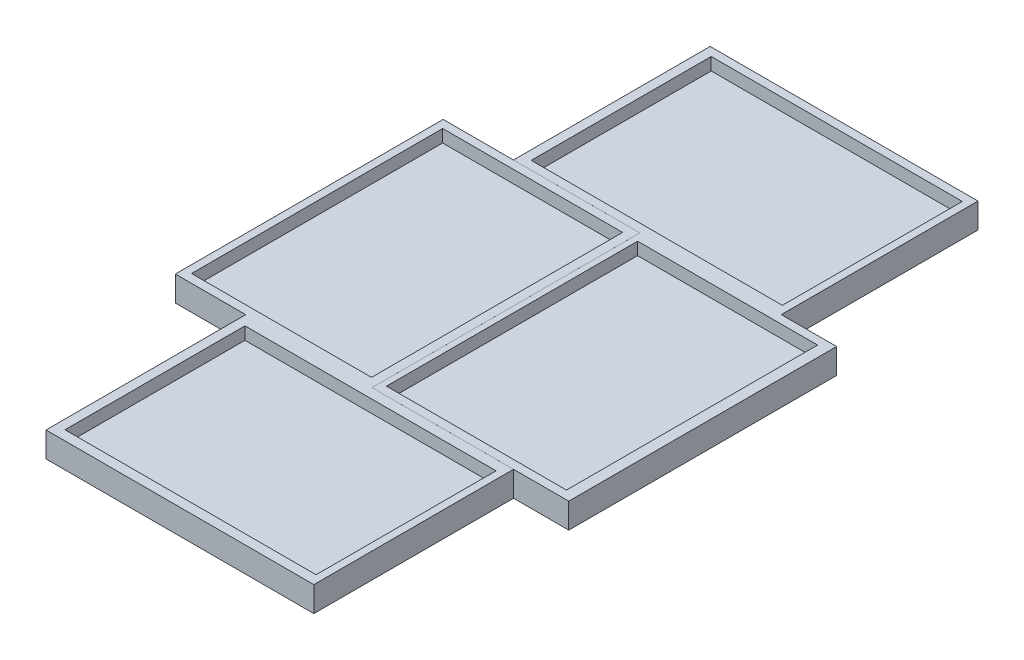
from build123d import *

# Parameters (mm, degrees)
SKETCH_1_W          = 64
SKETCH_1_H          = 47
SKETCH_1_H_2        = 47.71926336
SKETCH_1_W_2        = 47
SKETCH_1_H_3        = 64
EXTRUDE_1_DEPTH     = 6
SKETCH_2_W          = 60
SKETCH_2_H          = 43
SKETCH_2_W_2        = 43
SKETCH_2_H_2        = 60
CUT_EXTRUDE_1_DEPTH = 3


with BuildPart() as part:
    # 草图1 → 凸台-拉伸1 (new body)
    with BuildSketch(Plane(origin=(0, 0, 0), x_dir=(1, 0, 0), z_dir=(0, 1, 0))):
        with Locations((4.310126327, 35.497193317)):
            Rectangle(SKETCH_1_W, SKETCH_1_H)
        Polygon((49.519053615, 11.997193317), (36.310126327, 11.997193317), (2.519053615, 11.997193317), (2.519053615, -52.002806683), (49.519053615, -52.002806683), align=None)
        with Locations((4.33350212, -75.864199044)):
            Rectangle(SKETCH_1_W, SKETCH_1_H_2)
        with Locations((-20.982571512, -20.004567364)):
            Rectangle(SKETCH_1_W_2, SKETCH_1_H_3)
    extrude(amount=EXTRUDE_1_DEPTH)

    # 草图2 → 切除-拉伸1 (cut)
    with BuildSketch(Plane(origin=(0, 6, 0), x_dir=(1, 0, 0), z_dir=(0, 1, 0))):
        with Locations((4.51896996, 35.538893407)):
            Rectangle(SKETCH_2_W, SKETCH_2_H)
        with Locations((4.558396391, -75.907591109)):
            Rectangle(SKETCH_2_W, SKETCH_2_H)
        with Locations((25.448357336, -19.977193446)):
            Rectangle(SKETCH_2_W_2, SKETCH_2_H_2)
        with Locations((-21.160835481, -19.952332993)):
            Rectangle(SKETCH_2_W_2, SKETCH_2_H_2)
    extrude(amount=-CUT_EXTRUDE_1_DEPTH, mode=Mode.SUBTRACT)


solid = part.part
